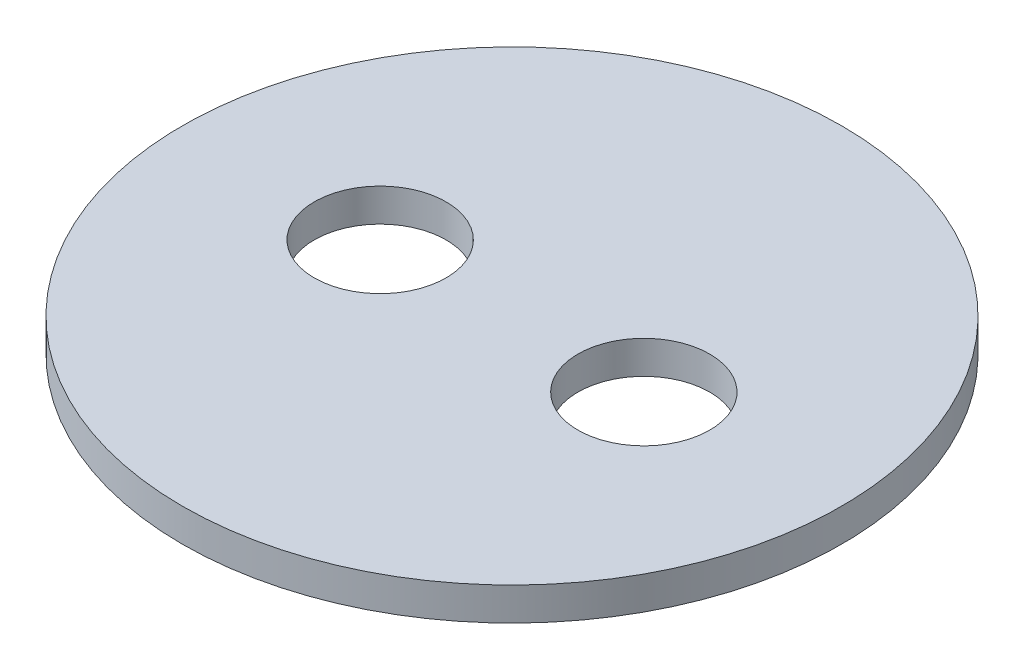
from build123d import *

# Parameters (mm, degrees)
SKETCH1_R           = 10
SKETCH1_R_2         = 2
BOSS_EXTRUDE1_DEPTH = 1


with BuildPart() as part:
    # Sketch1 → Boss-Extrude1 (new body)
    with BuildSketch(Plane(origin=(0, 0, 0), x_dir=(1, 0, 0), z_dir=(0, 1, 0))):
        with Locations(Location((0, 0, 0), (0, 0, 270))):
            Circle(SKETCH1_R)
        with Locations(Location((-4, 0, 0), (0, 0, 270))):
            Circle(SKETCH1_R_2, mode=Mode.SUBTRACT)
        with Locations(Location((4, 0, 0), (0, 0, 90))):
            Circle(SKETCH1_R_2, mode=Mode.SUBTRACT)
    extrude(amount=BOSS_EXTRUDE1_DEPTH)


solid = part.part
